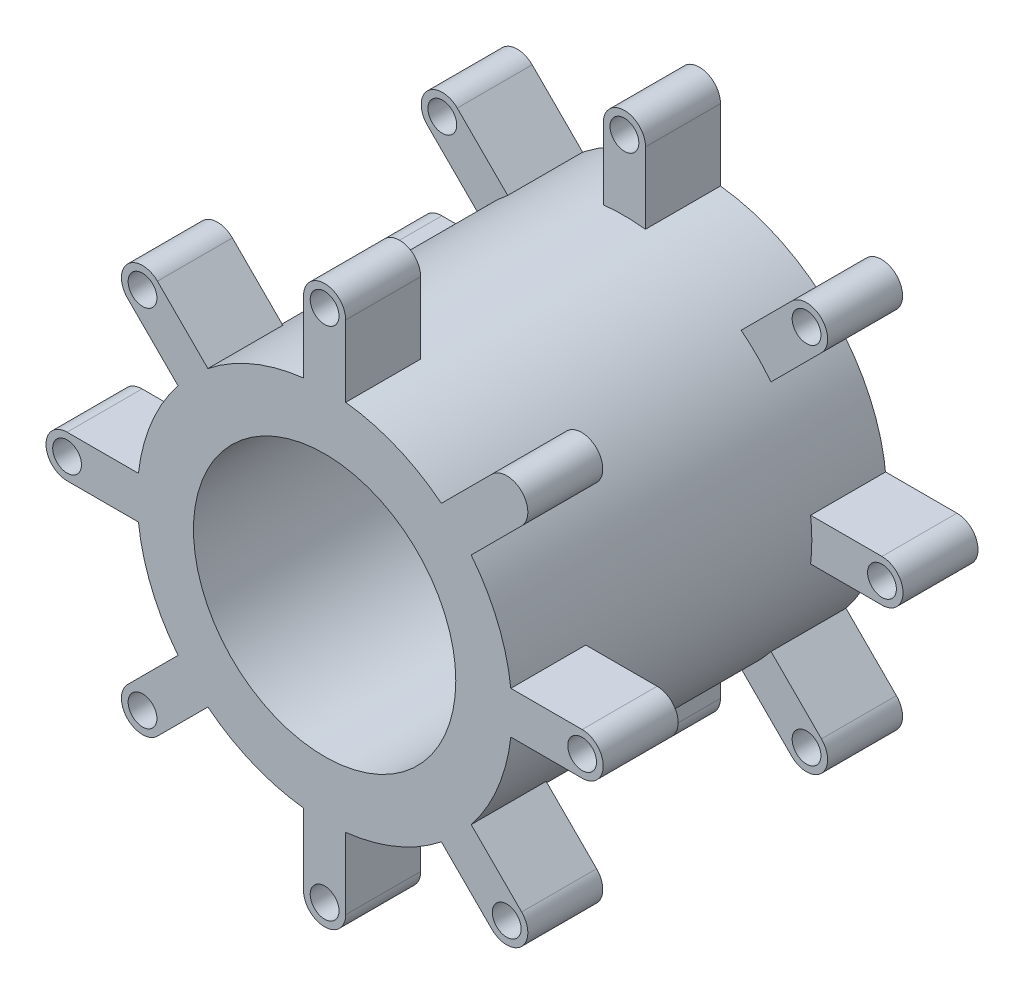
from build123d import *

# Parameters (mm, degrees)
SKETCH1_R             = 35
BOSS_EXTRUDE1_DEPTH   = 100
SKETCH1_5_R           = 3.843285091
BOSS_EXTRUDE5_DEPTH   = 20
BOSS_EXTRUDE5_2_DEPTH = 20
BOSS_EXTRUDE5_3_DEPTH = 20
BOSS_EXTRUDE5_4_DEPTH = 20
BOSS_EXTRUDE5_5_DEPTH = 20
BOSS_EXTRUDE5_6_DEPTH = 20
BOSS_EXTRUDE5_7_DEPTH = 20
BOSS_EXTRUDE5_8_DEPTH = 20
BOSS_EXTRUDE6_START   = -20
SKETCH2_R             = 3.843285091
BOSS_EXTRUDE6_DEPTH   = 20


with BuildPart() as part:
    # Sketch1 → Boss-Extrude1 (new body)
    with BuildSketch(Plane.XY):
        with BuildLine():
            ThreePointArc((50, 0), (49.920507728, 2.818316545), (49.682283674, 5.627671714))
            ThreePointArc((49.682283674, 5.627671714), (46.193976626, 19.134171618), (39.110044522, 31.15131486))
            ThreePointArc((39.110044522, 31.15131486), (35.355339059, 35.355339059), (31.15131486, 39.110044522))
            ThreePointArc((31.15131486, 39.110044522), (19.134171618, 46.193976626), (5.627671714, 49.682283674))
            ThreePointArc((5.627671714, 49.682283674), (0, 50), (-5.627671714, 49.682283674))
            ThreePointArc((-5.627671714, 49.682283674), (-19.134171618, 46.193976626), (-31.15131486, 39.110044522))
            ThreePointArc((-31.15131486, 39.110044522), (-35.355339059, 35.355339059), (-39.110044522, 31.15131486))
            ThreePointArc((-39.110044522, 31.15131486), (-46.193976626, 19.134171618), (-49.682283674, 5.627671714))
            ThreePointArc((-49.682283674, 5.627671714), (-50, 0), (-49.682283674, -5.627671714))
            ThreePointArc((-49.682283674, -5.627671714), (-46.193976626, -19.134171618), (-39.110044522, -31.15131486))
            ThreePointArc((-39.110044522, -31.15131486), (-35.355339059, -35.355339059), (-31.15131486, -39.110044522))
            ThreePointArc((-31.15131486, -39.110044522), (-19.134171618, -46.193976626), (-5.627671714, -49.682283674))
            ThreePointArc((-5.627671714, -49.682283674), (0, -50), (5.627671714, -49.682283674))
            ThreePointArc((5.627671714, -49.682283674), (19.134171618, -46.193976626), (31.15131486, -39.110044522))
            ThreePointArc((31.15131486, -39.110044522), (35.355339059, -35.355339059), (39.110044522, -31.15131486))
            ThreePointArc((39.110044522, -31.15131486), (46.193976626, -19.134171618), (49.682283674, -5.627671714))
            ThreePointArc((49.682283674, -5.627671714), (49.920507728, -2.818316545), (50, 0))
        make_face()
        Circle(SKETCH1_R, mode=Mode.SUBTRACT)
    extrude(amount=BOSS_EXTRUDE1_DEPTH)

    # Sketch2 → Boss-Extrude6 (add)
    # profile 1 of 8: a face of its own
    with BuildSketch(Plane.XY.offset(100).offset(BOSS_EXTRUDE6_START)):
        with BuildLine():
            ThreePointArc((-39.110044522, 31.15131486), (-35.355339059, 35.355339059), (-31.15131486, 39.110044522))
            Line((-31.15131486, 39.110044522), (-44.61077416, 52.569503822))
            ThreePointArc((-44.61077416, 52.569503822), (-52.569503822, 52.569503822), (-52.569503822, 44.61077416))
            Line((-52.569503822, 44.61077416), (-39.110044522, 31.15131486))
        make_face()
        with Locations((-48.590138991, 48.590138991)):
            Circle(SKETCH2_R, mode=Mode.SUBTRACT)
    # profile 2 of 8: a face of its own
    with BuildSketch(Plane.XY.offset(100).offset(BOSS_EXTRUDE6_START)):
        with BuildLine():
            Line((-5.627671714, 68.716833559), (-5.627671714, 49.682283674))
            ThreePointArc((-5.627671714, 49.682283674), (0, 50), (5.627671714, 49.682283674))
            Line((5.627671714, 49.682283674), (5.627671714, 68.716833559))
            ThreePointArc((5.627671714, 68.716833559), (0, 74.344505272), (-5.627671714, 68.716833559))
        make_face()
        with Locations((0, 68.716833559)):
            Circle(SKETCH2_R, mode=Mode.SUBTRACT)
    # profile 3 of 8: a face of its own
    with BuildSketch(Plane.XY.offset(100).offset(BOSS_EXTRUDE6_START)):
        with BuildLine():
            ThreePointArc((-49.682283674, -5.627671714), (-50, 0), (-49.682283674, 5.627671714))
            Line((-49.682283674, 5.627671714), (-68.716833559, 5.627671714))
            ThreePointArc((-68.716833559, 5.627671714), (-74.344505272, 0), (-68.716833559, -5.627671714))
            Line((-68.716833559, -5.627671714), (-49.682283674, -5.627671714))
        make_face()
        with Locations((-68.716833559, 0)):
            Circle(SKETCH2_R, mode=Mode.SUBTRACT)
    # profile 4 of 8: a face of its own
    with BuildSketch(Plane.XY.offset(100).offset(BOSS_EXTRUDE6_START)):
        with BuildLine():
            Line((44.61077416, 52.569503822), (31.15131486, 39.110044522))
            ThreePointArc((31.15131486, 39.110044522), (35.355339059, 35.355339059), (39.110044522, 31.15131486))
            Line((39.110044522, 31.15131486), (52.569503822, 44.61077416))
            ThreePointArc((52.569503822, 44.61077416), (52.569503822, 52.569503822), (44.61077416, 52.569503822))
        make_face()
    # profile 5 of 8: a face of its own
    with BuildSketch(Plane.XY.offset(100).offset(BOSS_EXTRUDE6_START)):
        with BuildLine():
            ThreePointArc((-31.15131486, -39.110044522), (-35.355339059, -35.355339059), (-39.110044522, -31.15131486))
            Line((-39.110044522, -31.15131486), (-52.569503822, -44.61077416))
            ThreePointArc((-52.569503822, -44.61077416), (-52.569503822, -52.569503822), (-44.61077416, -52.569503822))
            Line((-44.61077416, -52.569503822), (-31.15131486, -39.110044522))
        make_face()
        with Locations((-48.590138991, -48.590138991)):
            Circle(SKETCH2_R, mode=Mode.SUBTRACT)
    # profile 6 of 8: a face of its own
    with BuildSketch(Plane.XY.offset(100).offset(BOSS_EXTRUDE6_START)):
        with BuildLine():
            Line((68.716833559, 5.627671714), (49.682283674, 5.627671714))
            ThreePointArc((49.682283674, 5.627671714), (50, 0), (49.682283674, -5.627671714))
            Line((49.682283674, -5.627671714), (68.716833559, -5.627671714))
            ThreePointArc((68.716833559, -5.627671714), (74.344505272, 0), (68.716833559, 5.627671714))
        make_face()
        with Locations((68.716833559, 0)):
            Circle(SKETCH2_R, mode=Mode.SUBTRACT)
    # profile 7 of 8: a face of its own
    with BuildSketch(Plane.XY.offset(100).offset(BOSS_EXTRUDE6_START)):
        with BuildLine():
            ThreePointArc((5.627671714, -49.682283674), (0, -50), (-5.627671714, -49.682283674))
            Line((-5.627671714, -49.682283674), (-5.627671714, -68.716833559))
            ThreePointArc((-5.627671714, -68.716833559), (0, -74.344505272), (5.627671714, -68.716833559))
            Line((5.627671714, -68.716833559), (5.627671714, -49.682283674))
        make_face()
        with Locations((0, -68.716833559)):
            Circle(SKETCH2_R, mode=Mode.SUBTRACT)
    # profile 8 of 8: a face of its own
    with BuildSketch(Plane.XY.offset(100).offset(BOSS_EXTRUDE6_START)):
        with BuildLine():
            ThreePointArc((39.110044522, -31.15131486), (35.355339059, -35.355339059), (31.15131486, -39.110044522))
            Line((31.15131486, -39.110044522), (44.61077416, -52.569503822))
            ThreePointArc((44.61077416, -52.569503822), (52.569503822, -52.569503822), (52.569503822, -44.61077416))
            Line((52.569503822, -44.61077416), (39.110044522, -31.15131486))
        make_face()
        with Locations((48.590138991, -48.590138991)):
            Circle(SKETCH2_R, mode=Mode.SUBTRACT)
    extrude(amount=BOSS_EXTRUDE6_DEPTH)


with BuildPart() as body_2:
    # Sketch1<5> → Boss-Extrude5 (new body)
    with BuildSketch(Plane.XY):
        with BuildLine():
            Line((68.716833559, 5.627671714), (49.682283674, 5.627671714))
            ThreePointArc((49.682283674, 5.627671714), (50, 0), (49.682283674, -5.627671714))
            Line((49.682283674, -5.627671714), (68.716833559, -5.627671714))
            ThreePointArc((68.716833559, -5.627671714), (74.344505272, 0), (68.716833559, 5.627671714))
        make_face()
        with Locations((68.716833559, 0)):
            Circle(SKETCH1_5_R, mode=Mode.SUBTRACT)
    extrude(amount=BOSS_EXTRUDE5_DEPTH)


with BuildPart() as body_3:
    # Sketch1<5> → Boss-Extrude5 2 (new body)
    with BuildSketch(Plane.XY):
        with BuildLine():
            ThreePointArc((31.15131486, 39.110044522), (35.355339059, 35.355339059), (39.110044522, 31.15131486))
            Line((39.110044522, 31.15131486), (52.569503822, 44.61077416))
            ThreePointArc((52.569503822, 44.61077416), (52.569503822, 52.569503822), (44.61077416, 52.569503822))
            Line((44.61077416, 52.569503822), (31.15131486, 39.110044522))
        make_face()
        with Locations((48.590138991, 48.590138991)):
            Circle(SKETCH1_5_R, mode=Mode.SUBTRACT)
    extrude(amount=BOSS_EXTRUDE5_2_DEPTH)


with BuildPart() as body_4:
    # Sketch1<5> → Boss-Extrude5 3 (new body)
    with BuildSketch(Plane.XY):
        with BuildLine():
            Line((52.569503822, -44.61077416), (39.110044522, -31.15131486))
            ThreePointArc((39.110044522, -31.15131486), (35.355339059, -35.355339059), (31.15131486, -39.110044522))
            Line((31.15131486, -39.110044522), (44.61077416, -52.569503822))
            ThreePointArc((44.61077416, -52.569503822), (52.569503822, -52.569503822), (52.569503822, -44.61077416))
        make_face()
        with Locations((48.590138991, -48.590138991)):
            Circle(SKETCH1_5_R, mode=Mode.SUBTRACT)
    extrude(amount=BOSS_EXTRUDE5_3_DEPTH)


with BuildPart() as body_5:
    # Sketch1<5> → Boss-Extrude5 4 (new body)
    with BuildSketch(Plane.XY):
        with BuildLine():
            ThreePointArc((-5.627671714, 49.682283674), (0, 50), (5.627671714, 49.682283674))
            Line((5.627671714, 49.682283674), (5.627671714, 68.716833559))
            ThreePointArc((5.627671714, 68.716833559), (0, 74.344505272), (-5.627671714, 68.716833559))
            Line((-5.627671714, 68.716833559), (-5.627671714, 49.682283674))
        make_face()
        with Locations((0, 68.716833559)):
            Circle(SKETCH1_5_R, mode=Mode.SUBTRACT)
    extrude(amount=BOSS_EXTRUDE5_4_DEPTH)


with BuildPart() as body_6:
    # Sketch1<5> → Boss-Extrude5 5 (new body)
    with BuildSketch(Plane.XY):
        with BuildLine():
            Line((5.627671714, -68.716833559), (5.627671714, -49.682283674))
            ThreePointArc((5.627671714, -49.682283674), (0, -50), (-5.627671714, -49.682283674))
            Line((-5.627671714, -49.682283674), (-5.627671714, -68.716833559))
            ThreePointArc((-5.627671714, -68.716833559), (0, -74.344505272), (5.627671714, -68.716833559))
        make_face()
        with Locations((0, -68.716833559)):
            Circle(SKETCH1_5_R, mode=Mode.SUBTRACT)
    extrude(amount=BOSS_EXTRUDE5_5_DEPTH)


with BuildPart() as body_7:
    # Sketch1<5> → Boss-Extrude5 6 (new body)
    with BuildSketch(Plane.XY):
        with BuildLine():
            ThreePointArc((-39.110044522, 31.15131486), (-35.355339059, 35.355339059), (-31.15131486, 39.110044522))
            Line((-31.15131486, 39.110044522), (-44.61077416, 52.569503822))
            ThreePointArc((-44.61077416, 52.569503822), (-52.569503822, 52.569503822), (-52.569503822, 44.61077416))
            Line((-52.569503822, 44.61077416), (-39.110044522, 31.15131486))
        make_face()
        with Locations((-48.590138991, 48.590138991)):
            Circle(SKETCH1_5_R, mode=Mode.SUBTRACT)
    extrude(amount=BOSS_EXTRUDE5_6_DEPTH)


with BuildPart() as body_8:
    # Sketch1<5> → Boss-Extrude5 7 (new body)
    with BuildSketch(Plane.XY):
        with BuildLine():
            Line((-44.61077416, -52.569503822), (-31.15131486, -39.110044522))
            ThreePointArc((-31.15131486, -39.110044522), (-35.355339059, -35.355339059), (-39.110044522, -31.15131486))
            Line((-39.110044522, -31.15131486), (-52.569503822, -44.61077416))
            ThreePointArc((-52.569503822, -44.61077416), (-52.569503822, -52.569503822), (-44.61077416, -52.569503822))
        make_face()
        with Locations((-48.590138991, -48.590138991)):
            Circle(SKETCH1_5_R, mode=Mode.SUBTRACT)
    extrude(amount=BOSS_EXTRUDE5_7_DEPTH)


with BuildPart() as body_9:
    # Sketch1<5> → Boss-Extrude5 8 (new body)
    with BuildSketch(Plane.XY):
        with BuildLine():
            ThreePointArc((-49.682283674, -5.627671714), (-50, 0), (-49.682283674, 5.627671714))
            Line((-49.682283674, 5.627671714), (-68.716833559, 5.627671714))
            ThreePointArc((-68.716833559, 5.627671714), (-74.344505272, 0), (-68.716833559, -5.627671714))
            Line((-68.716833559, -5.627671714), (-49.682283674, -5.627671714))
        make_face()
        with Locations((-68.716833559, 0)):
            Circle(SKETCH1_5_R, mode=Mode.SUBTRACT)
    extrude(amount=BOSS_EXTRUDE5_8_DEPTH)


solid = Compound([part.part, body_2.part, body_3.part, body_4.part, body_5.part, body_6.part, body_7.part, body_8.part, body_9.part])
